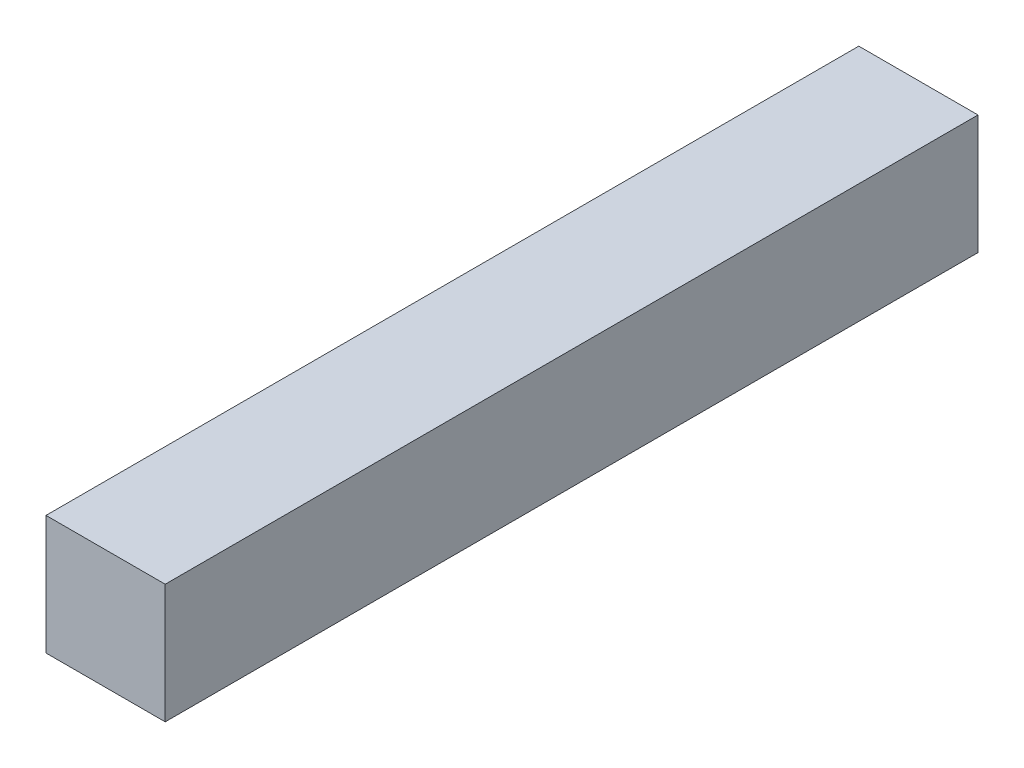
from build123d import *

# Parameters (mm, degrees)
SKETCH1_W           = 22
SKETCH1_H           = 22
BOSS_EXTRUDE1_DEPTH = 150


with BuildPart() as part:
    # Sketch1 → Boss-Extrude1 (new body)
    with BuildSketch(Plane.XY):
        Rectangle(SKETCH1_W, SKETCH1_H)
    extrude(amount=BOSS_EXTRUDE1_DEPTH)


solid = part.part
